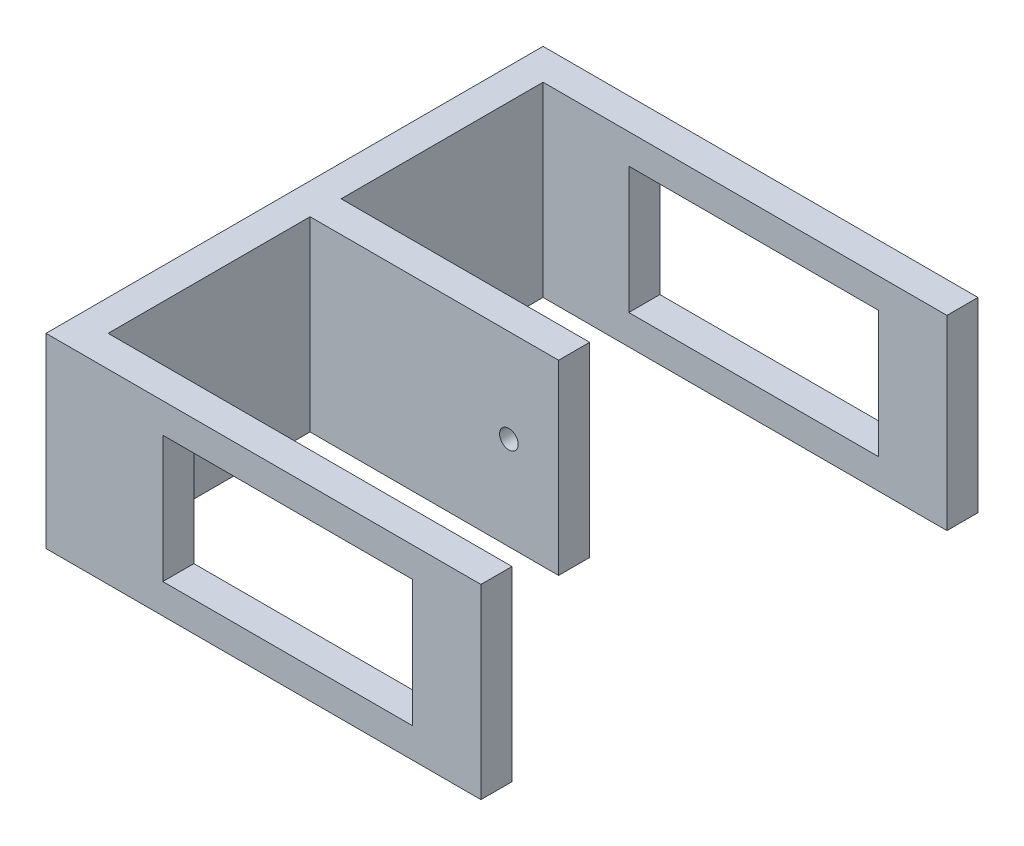
from build123d import *

# Parameters (mm, degrees)
SKETCH_1_W          = 70
SKETCH_1_H          = 30
EXTRUDE_1_DEPTH     = 5
SKETCH_2_W          = 5
SKETCH_2_H          = 30
EXTRUDE_2_DEPTH     = 75
SKETCH_3_W          = 5
SKETCH_3_H          = 30
EXTRUDE_3_DEPTH     = 65
SKETCH_4_W          = 5
SKETCH_4_H          = 30
EXTRUDE_4_DEPTH     = 40
CUT_EXTRUDE_3_REACH = 112.454
SKETCH_6_W          = 40.2
SKETCH_6_H          = 20.4
CUT_EXTRUDE_4_REACH = 112.454
SKETCH_7_W          = 40.2
SKETCH_7_H          = 20.4
CUT_EXTRUDE_5_REACH = 89.214
SKETCH_5_R          = 1.5


with BuildPart() as part:
    # 草图1 → 凸台-拉伸1 (new body)
    with BuildSketch(Plane.XY):
        with Locations((35, 15)):
            Rectangle(SKETCH_1_W, SKETCH_1_H)
    extrude(amount=EXTRUDE_1_DEPTH)

    # 草图2 → 凸台-拉伸2 (add)
    with BuildSketch(Plane.XY.offset(5)):
        with Locations((2.5, 15)):
            Rectangle(SKETCH_2_W, SKETCH_2_H)
    extrude(amount=EXTRUDE_2_DEPTH)

    # 草图3 → 凸台-拉伸3 (add)
    with BuildSketch(Plane(origin=(5, 0, 0), x_dir=(0, 0, -1), z_dir=(1, 0, 0))):
        with Locations((-77.5, 15)):
            Rectangle(SKETCH_3_W, SKETCH_3_H)
    extrude(amount=EXTRUDE_3_DEPTH)

    # 草图4 → 凸台-拉伸4 (add)
    with BuildSketch(Plane(origin=(5, 0, 0), x_dir=(0, 0, -1), z_dir=(1, 0, 0))):
        with Locations((-40, 15)):
            Rectangle(SKETCH_4_W, SKETCH_4_H)
    extrude(amount=EXTRUDE_4_DEPTH)

    # 草图6 → 切除-拉伸3 (cut, up to next)
    with BuildSketch(Plane(origin=(0, 0, 0), x_dir=(-1, 0, 0), z_dir=(0, 0, -1)), mode=Mode.PRIVATE) as cut_extrude_3_sk1:
        with Locations((-38.9, 15)):
            Rectangle(SKETCH_6_W, SKETCH_6_H)
    cut_extrude_3_tool1 = extrude(cut_extrude_3_sk1.sketch, amount=-CUT_EXTRUDE_3_REACH, mode=Mode.PRIVATE) & part.part
    add(cut_extrude_3_tool1.solids().sort_by_distance((38.9, 15, 0))[0], mode=Mode.SUBTRACT)

    # 草图7 → 切除-拉伸4 (cut, up to next)
    with BuildSketch(Plane.XY.offset(80), mode=Mode.PRIVATE) as cut_extrude_4_sk1:
        with Locations((38.9, 15)):
            Rectangle(SKETCH_7_W, SKETCH_7_H)
    cut_extrude_4_tool1 = extrude(cut_extrude_4_sk1.sketch, amount=-CUT_EXTRUDE_4_REACH, mode=Mode.PRIVATE) & part.part
    add(cut_extrude_4_tool1.solids().sort_by_distance((38.9, 15, 80))[0], mode=Mode.SUBTRACT)

    # 草图5 → 切除-拉伸5 (cut, up to next)
    with BuildSketch(Plane.XY.offset(42.5), mode=Mode.PRIVATE) as cut_extrude_5_sk1:
        with Locations((37, 15)):
            Circle(SKETCH_5_R)
    cut_extrude_5_tool1 = extrude(cut_extrude_5_sk1.sketch, amount=-CUT_EXTRUDE_5_REACH, mode=Mode.PRIVATE) & part.part
    add(cut_extrude_5_tool1.solids().sort_by_distance((37, 15, 42.5))[0], mode=Mode.SUBTRACT)


solid = part.part
